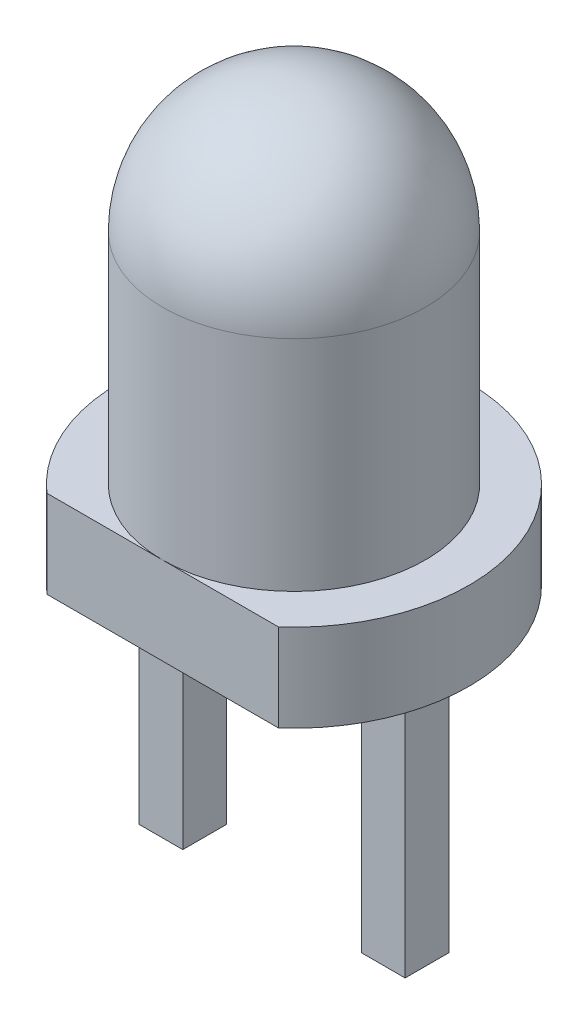
from build123d import *

# Parameters (mm, degrees)
BOSS_EXTRUDE1_DEPTH   = 1
SKETCH3_W             = 0.5
SKETCH3_H             = 0.5
BOSS_EXTRUDE2_DEPTH   = 3
BOSS_EXTRUDE2_2_DEPTH = 3


with BuildPart() as part:
    # Sketch1 → Revolve1 (revolve)
    with BuildSketch(Plane(origin=(0, 0, 0), x_dir=(0, 0, -1), z_dir=(1, 0, 0))):
        with BuildLine():
            Line((-1.5, 0), (-1.5, 3.5))
            ThreePointArc((-1.5, 3.5), (-1.060660172, 4.560660172), (0, 5))
            Line((0, 5), (0, 0))
            Line((0, 0), (-1.5, 0))
        make_face()
    revolve(axis=Axis((0, 5, 0), (0, -1, 0)))

    # Sketch2 → Boss-Extrude1 (add)
    with BuildSketch(Plane(origin=(0, 0, 0), x_dir=(1, 0, 0), z_dir=(0, 1, 0))):
        with BuildLine():
            Line((-1.322875656, -1.5), (1.322875656, -1.5))
            ThreePointArc((1.322875656, -1.5), (0, 2), (-1.322875656, -1.5))
        make_face()
    extrude(amount=BOSS_EXTRUDE1_DEPTH)


with BuildPart() as body_2:
    # Sketch3 → Boss-Extrude2 (new body)
    with BuildSketch(Plane.XZ):
        with Locations((-1.27, 0)):
            Rectangle(SKETCH3_W, SKETCH3_H)
    extrude(amount=BOSS_EXTRUDE2_DEPTH)


with BuildPart() as body_3:
    # Sketch3 → Boss-Extrude2 2 (new body)
    with BuildSketch(Plane.XZ):
        with Locations((1.27, 0)):
            Rectangle(SKETCH3_W, SKETCH3_H)
    extrude(amount=BOSS_EXTRUDE2_2_DEPTH)


solid = Compound([part.part, body_2.part, body_3.part])
